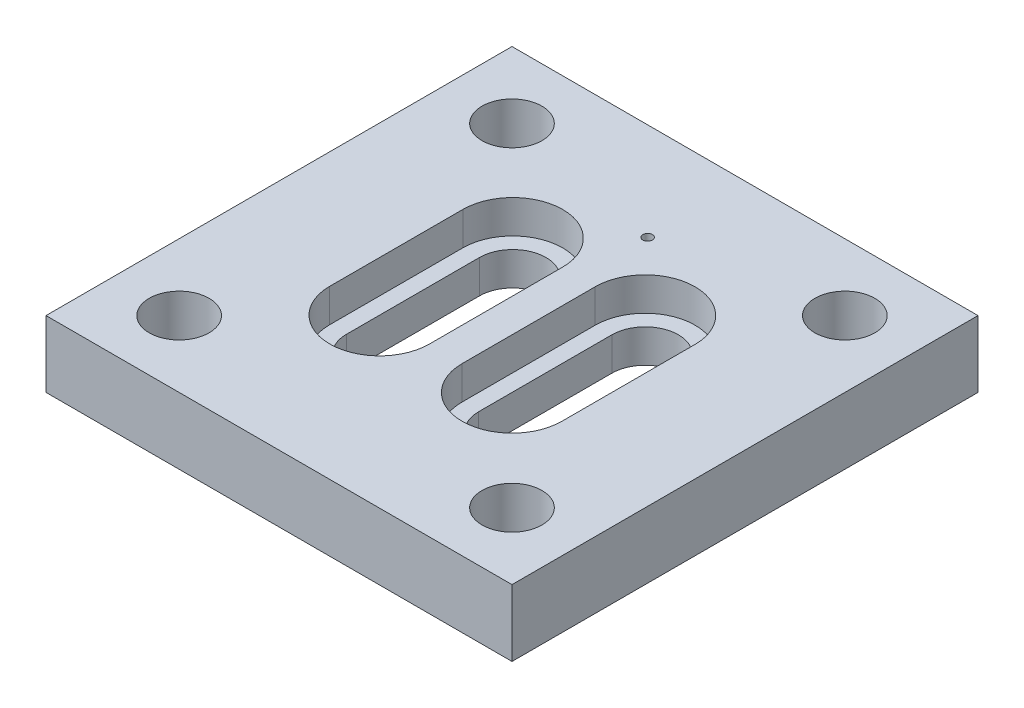
from build123d import *

# Parameters (mm, degrees)
IZIM1_W                     = 140
IZIM1_H                     = 140
IZIM1_R                     = 9
Y_KSEKLIK_EKSTR_ZYON1_DEPTH = 20
KES_EKSTR_ZYON1_DEPTH       = 10
KES_EKSTR_ZYON2_DEPTH       = 101.995049384


with BuildPart() as part:
    # Çizim1 → Yükseklik-Ekstrüzyon1 (new body)
    with BuildSketch(Plane(origin=(0, 0, 0), x_dir=(1, 0, 0), z_dir=(0, 1, 0))):
        Rectangle(IZIM1_W, IZIM1_H)
        with Locations(Location((-50, 50, 0), (0, 0, 270))):
            Circle(IZIM1_R, mode=Mode.SUBTRACT)
        with Locations(Location((50, 50, 0), (0, 0, 270))):
            Circle(IZIM1_R, mode=Mode.SUBTRACT)
        with Locations(Location((-50, -50, 0), (0, 0, 270))):
            Circle(IZIM1_R, mode=Mode.SUBTRACT)
        with Locations(Location((50, -50, 0), (0, 0, 270))):
            Circle(IZIM1_R, mode=Mode.SUBTRACT)
    extrude(amount=-Y_KSEKLIK_EKSTR_ZYON1_DEPTH)

    # Çizim4 → Kes-Ekstrüzyon1 (cut)
    # profile 1 of 2: a face of its own
    with BuildSketch(Plane(origin=(0, 0, 0), x_dir=(1, 0, 0), z_dir=(0, 1, 0))):
        with BuildLine():
            Line((-5, 20.227170593), (-5, -19.772829407))
            ThreePointArc((-5, -19.772829407), (-20, -34.772829407), (-35, -19.772829407))
            Line((-35, -19.772829407), (-35, 20.227170593))
            ThreePointArc((-35, 20.227170593), (-20, 35.227170593), (-5, 20.227170593))
        make_face()
        with BuildLine():
            Line((-30, 20.227170593), (-30, -19.772829407))
            ThreePointArc((-30, -19.772829407), (-20, -29.772829407), (-10, -19.772829407))
            Line((-10, -19.772829407), (-10, 20.227170593))
            ThreePointArc((-10, 20.227170593), (-20, 30.227170593), (-30, 20.227170593))
        make_face(mode=Mode.SUBTRACT)
    # profile 2 of 2: a face of its own
    with BuildSketch(Plane(origin=(0, 0, 0), x_dir=(1, 0, 0), z_dir=(0, 1, 0))):
        with BuildLine():
            Line((35, 20), (35, -20))
            ThreePointArc((35, -20), (20, -35), (5, -20))
            Line((5, -20), (5, 20))
            ThreePointArc((5, 20), (20, 35), (35, 20))
        make_face()
        with BuildLine():
            Line((30, 20), (30, -20))
            ThreePointArc((30, -20), (20, -30), (10, -20))
            Line((10, -20), (10, 20))
            ThreePointArc((10, 20), (20, 30), (30, 20))
        make_face(mode=Mode.SUBTRACT)
    extrude(amount=-KES_EKSTR_ZYON1_DEPTH, mode=Mode.SUBTRACT)

    # Çizim2 → Kes-Ekstrüzyon2 (cut, through all)
    with BuildSketch(Plane(origin=(0, -20, 0), x_dir=(-1, 0, 0), z_dir=(0, -1, 0))):
        with BuildLine():
            Line((-10, 20), (-10, -20))
            ThreePointArc((-10, -20), (-20, -30), (-30, -20))
            Line((-30, -20), (-30, 20))
            ThreePointArc((-30, 20), (-20, 30), (-10, 20))
        make_face()
        with BuildLine():
            Line((30, 20.227170593), (30, -19.772829407))
            ThreePointArc((30, -19.772829407), (20, -29.772829407), (10, -19.772829407))
            Line((10, -19.772829407), (10, 20.227170593))
            ThreePointArc((10, 20.227170593), (20, 30.227170593), (30, 20.227170593))
        make_face()
    extrude(amount=-KES_EKSTR_ZYON2_DEPTH, mode=Mode.SUBTRACT)

    # Çizim6 → #6-40 Dişli Delik1 (revolve, cut)
    with BuildSketch(Plane(origin=(0, 0, -40.730803154), x_dir=(0, 0, 1), z_dir=(1, 0, 0))):
        Polygon((0, 0), (0, 20), (2.3876, 20), (1.4351, 19.0475), (1.4351, 0), align=None)
    revolve(axis=Axis((0, 6.35, -40.730803154), (0, -1, 0)), mode=Mode.SUBTRACT)


solid = part.part
